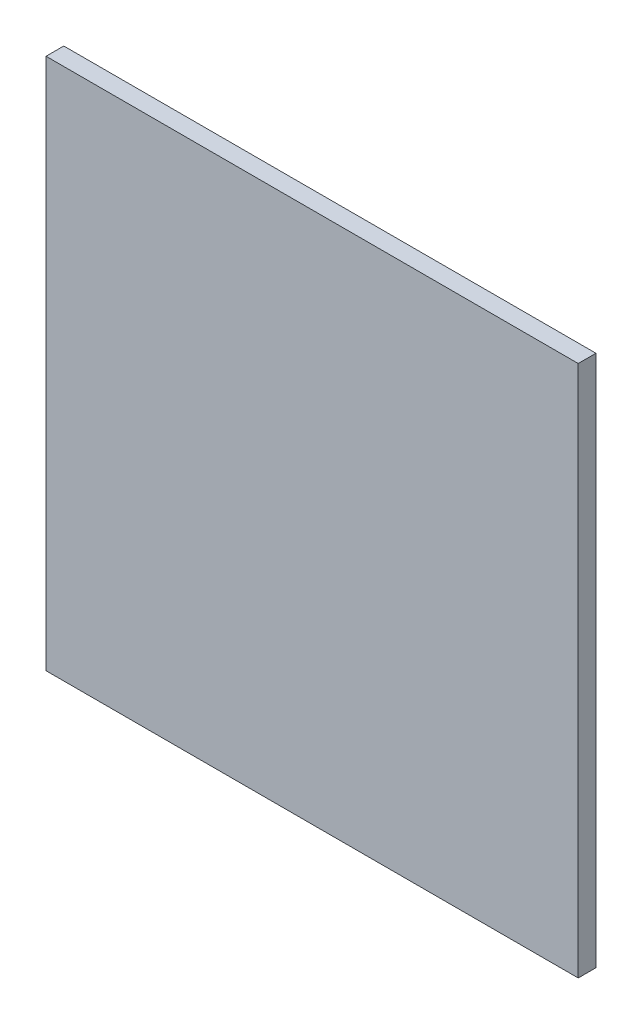
from build123d import *

# Parameters (mm, degrees)
SKETCH1_W   = 30
SKETCH1_H   = 30
THICKEN1_T1 = 1


with BuildPart() as body_1:
    # Sketch1 → Surface-Plane1: a flat surface bounded by the sketch
    with BuildSketch(Plane.XY, mode=Mode.PRIVATE) as surface_plane1_1_region:
        with Locations((15, 15)):
            Rectangle(SKETCH1_W, SKETCH1_H)
    surface_plane1_1 = surface_plane1_1_region.sketch.faces()[0]
    add(Solid.thicken(surface_plane1_1, THICKEN1_T1))


solid = body_1.part
